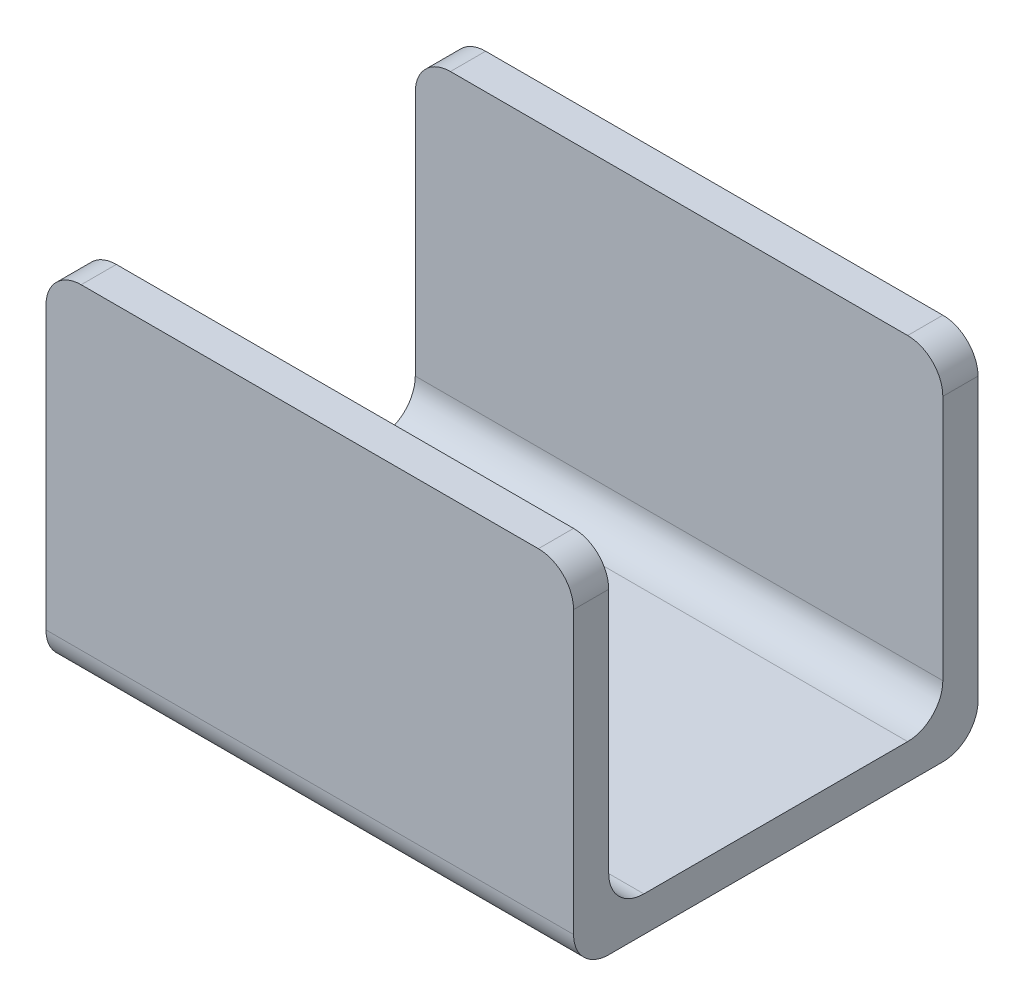
from build123d import *

# Parameters (mm, degrees)
AUFSATZ_LINEAR_AUSTRAGEN1_DEPTH = 30
VERRUNDUNG1_R                   = 4
VERRUNDUNG2_R                   = 4
VERRUNDUNG3_R                   = 4
VERRUNDUNG4_R                   = 4
VERRUNDUNG5_R                   = 4
VERRUNDUNG6_R                   = 4
VERRUNDUNG7_R                   = 4


with BuildPart() as part:
    # Skizze1 → Aufsatz-Linear austragen1 (new, symmetric)
    with BuildSketch(Plane(origin=(0, 0, 0), x_dir=(0, 0, -1), z_dir=(1, 0, 0))):
        Polygon((-23, 40), (-19, 40), (-19, 4), (19, 4), (19, 40), (23, 40), (23, 0), (-23, 0), align=None)
    extrude(amount=AUFSATZ_LINEAR_AUSTRAGEN1_DEPTH, both=True)

    # Verrundung1
    verrundung1_edges = [part.edges().sort_by_distance(p)[0] for p in [
        (0, 0, -23),
    ]]
    fillet(verrundung1_edges, radius=VERRUNDUNG1_R)

    # Verrundung2
    verrundung2_edges = [part.edges().sort_by_distance(p)[0] for p in [
        (0, 0, 23),
    ]]
    fillet(verrundung2_edges, radius=VERRUNDUNG2_R)

    # Verrundung3
    verrundung3_edges = [part.edges().sort_by_distance(p)[0] for p in [
        (-30, 40, -21),
    ]]
    fillet(verrundung3_edges, radius=VERRUNDUNG3_R)

    # Verrundung4
    verrundung4_edges = [part.edges().sort_by_distance(p)[0] for p in [
        (30, 40, -21),
    ]]
    fillet(verrundung4_edges, radius=VERRUNDUNG4_R)

    # Verrundung5
    verrundung5_edges = [part.edges().sort_by_distance(p)[0] for p in [
        (-30, 40, 21),
        (30, 40, 21),
    ]]
    fillet(verrundung5_edges, radius=VERRUNDUNG5_R)

    # Verrundung6
    verrundung6_edges = [part.edges().sort_by_distance(p)[0] for p in [
        (0, 4, 19),
    ]]
    fillet(verrundung6_edges, radius=VERRUNDUNG6_R)

    # Verrundung7
    verrundung7_edges = [part.edges().sort_by_distance(p)[0] for p in [
        (0, 4, -19),
    ]]
    fillet(verrundung7_edges, radius=VERRUNDUNG7_R)


solid = part.part
